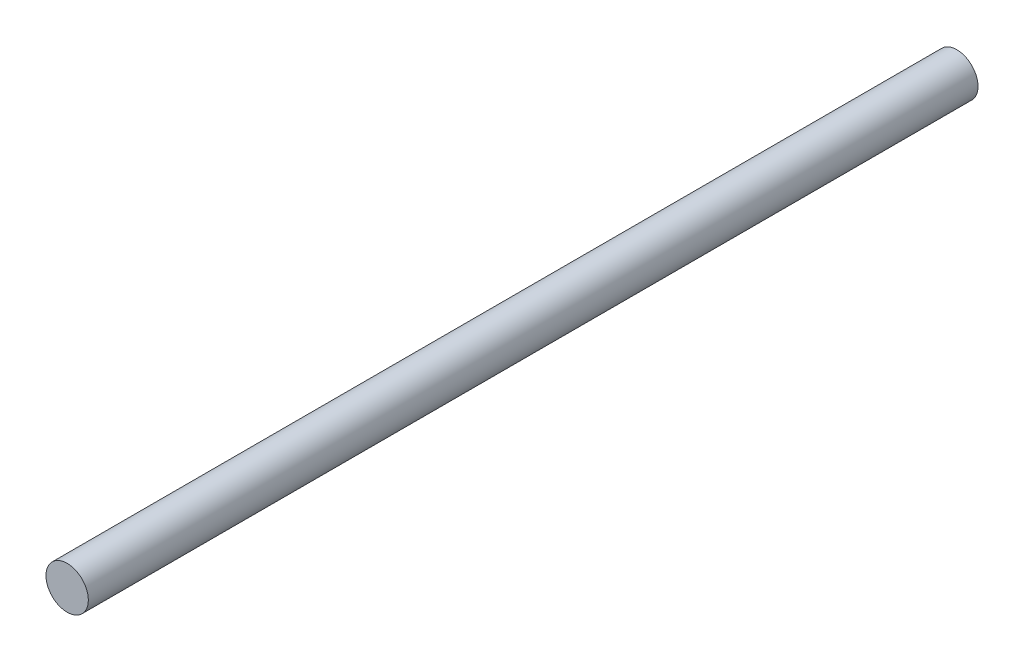
from build123d import *

# Parameters (mm, degrees)
SKETCH1_R           = 2.5
BOSS_EXTRUDE1_DEPTH = 105


with BuildPart() as part:
    # Sketch1 → Boss-Extrude1 (new body)
    with BuildSketch(Plane.XY):
        Circle(SKETCH1_R)
    extrude(amount=BOSS_EXTRUDE1_DEPTH)


solid = part.part
